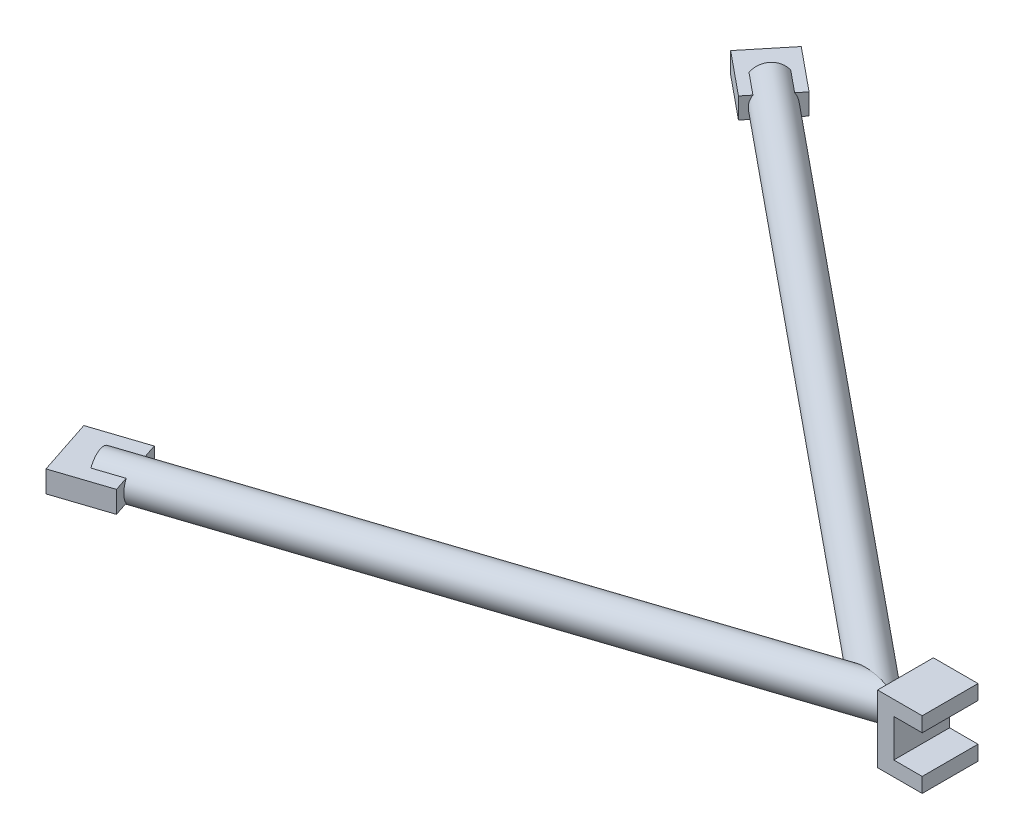
from build123d import *

# Parameters (mm, degrees)
SKETCH2_R                = 8.255
BOSS_EXTRUDE1_DEPTH      = 12.7
BOSS_EXTRUDE1_DEPTH_BACK = 12.7
BOSS_EXTRUDE2_DEPTH      = 12.7
BOSS_EXTRUDE2_DEPTH_BACK = 12.7
SKETCH4_W                = 27.044091096
SKETCH4_H                = 9.871476176
BOSS_EXTRUDE3_DEPTH      = 12.7
BOSS_EXTRUDE3_DEPTH_BACK = 12.7
SKETCH5_W                = 22.839690924
SKETCH5_H                = 9.521004572


with BuildPart() as part:
    # Sweep1: sweep along a path in Sketch1
    with BuildLine(Plane(origin=(0, 0, 0), x_dir=(1, 0, 0), z_dir=(0, 1, 0))) as sweep1_path:
        Line((-265.319834303, -87.577083333), (0, 0))
        Line((0, 0), (-265.319834303, 217.222916667))
    # Sketch2 → Sweep1 (sweep)
    with BuildSketch(Plane(origin=(-265.319834303, 0, 87.577083333), x_dir=(-0.3134469696969697, 0, -0.949605706168506), z_dir=(0.949605706168506, 0, -0.3134469696969697))):
        Circle(SKETCH2_R)
    sweep(path=sweep1_path.line, transition=Transition.RIGHT)

    # Sketch3 → Boss-Extrude1 (add, two sides: drawn at the far end of the back side and taken through both)
    with BuildSketch(Plane.XY.offset(-BOSS_EXTRUDE1_DEPTH_BACK)):
        Polygon((33.931753368, 15.31554454), (13.629365652, 15.31554454), (13.629365652, -15.31554454), (33.931753368, -15.31554454), (33.931753368, -8.593796811), (21.004584429, -8.593796811), (21.004584429, 8.593796811), (33.931753368, 8.593796811), align=None)
    extrude(amount=BOSS_EXTRUDE1_DEPTH + BOSS_EXTRUDE1_DEPTH_BACK)

    # Sketch4 → Boss-Extrude2 (add, two sides: drawn at the far end of the back side and taken through both)
    with BuildSketch(Plane(origin=(-265.319834303, 0, 87.577083333), x_dir=(0.3134469696969697, 0, 0.949605706168506), z_dir=(-0.949605706168506, 0, 0.3134469696969697)).offset(-BOSS_EXTRUDE2_DEPTH_BACK)):
        Rectangle(SKETCH4_W, SKETCH4_H)
    extrude(amount=BOSS_EXTRUDE2_DEPTH + BOSS_EXTRUDE2_DEPTH_BACK)

    # Sketch5 → Boss-Extrude3 (add, two sides: drawn at the far end of the back side and taken through both)
    with BuildSketch(Plane(origin=(-265.319834303, 0, -217.222916667), x_dir=(-0.633487654320988, 0, 0.7737527976187824), z_dir=(-0.7737527976187824, 0, -0.633487654320988)).offset(-BOSS_EXTRUDE3_DEPTH_BACK)):
        Rectangle(SKETCH5_W, SKETCH5_H)
    extrude(amount=BOSS_EXTRUDE3_DEPTH + BOSS_EXTRUDE3_DEPTH_BACK)


solid = part.part
